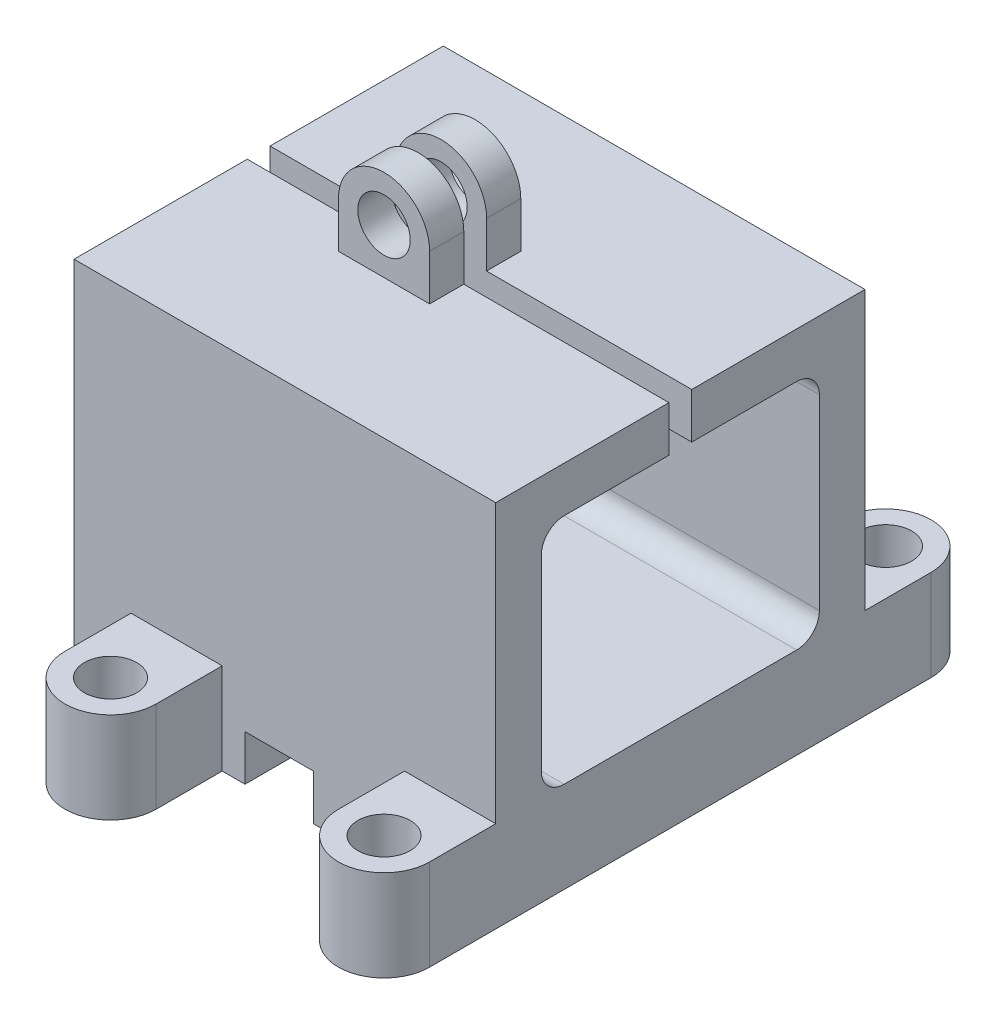
from build123d import *

# Parameters (mm, degrees)
SKETCH_1_W           = 8
SKETCH_1_H           = 5
SKETCH_1_R           = 1.15
EXTRUDE_1_DEPTH      = 4
SKETCH_2_W           = 10.5
SKETCH_2_H           = 8
SKETCH_2_R           = 1.15
EXTRUDE_2_DEPTH      = 7
EXTRUDE_4_DEPTH      = 15
SKETCH_6_R           = 1.15
EXTRUDE_5_DEPTH      = 1.5
EXTRUDE_START        = 2.5
SKETCH_6_2_R         = 1.15
EXTRUDE_6_DEPTH      = 1.5
CUT_EXTRUDE_2_DEPTH  = 3
FILLET_2_R           = 1
SKETCH_9_OUTSIDE_W   = 25.014
SKETCH_9_OUTSIDE_H   = 34.214
SKETCH_9_OUTSIDE_W_2 = 15
SKETCH_9_OUTSIDE_H_2 = 16.2
CUT_EXTRUDE_3_DEPTH  = 36.814522194
SKETCH_12_W          = 16.2
SKETCH_12_H          = 8
CUT_EXTRUDE_5_DEPTH  = 31.608495553
SKETCH_10_W          = 3
SKETCH_10_H          = 2
CUT_EXTRUDE_4_DEPTH  = 31.608495553
SKETCH_11_R          = 1.15
EXTRUDE_7_DEPTH      = 4
EXTRUDE_15_DEPTH     = 3.5


with BuildPart() as part:
    # 草图1 → 凸台-拉伸1 (new body)
    with BuildSketch(Plane(origin=(0, 0, 0), x_dir=(0, 0, -1), z_dir=(1, 0, 0))):
        with Locations((4, 2.5)):
            Rectangle(SKETCH_1_W, SKETCH_1_H)
        with Locations((2, 2.5)):
            Circle(SKETCH_1_R, mode=Mode.SUBTRACT)
        with Locations((6, 2.5)):
            Circle(SKETCH_1_R, mode=Mode.SUBTRACT)
    extrude(amount=EXTRUDE_1_DEPTH)

    # 草图2 → 凸台-拉伸2 (add)
    with BuildSketch(Plane.XZ):
        with Locations((5.25, -4)):
            Rectangle(SKETCH_2_W, SKETCH_2_H)
        with Locations(Location((8, -6, 0), (0, 0, 270))):
            Circle(SKETCH_2_R, mode=Mode.SUBTRACT)
        with Locations(Location((8, -2, 0), (0, 0, 270))):
            Circle(SKETCH_2_R, mode=Mode.SUBTRACT)
    extrude(amount=EXTRUDE_2_DEPTH)

    # 草图5 → 凸台-拉伸4 (add)
    with BuildSketch(Plane.ZY):
        Polygon((14.2, 5), (2, 5), (2, 15.2), (7.6, 15.2), (7.6, 17.2), (0, 17.2), (0, -7), (16.2, -7), (16.2, 17.2), (8.6, 17.2), (8.6, 15.2), (14.2, 15.2), align=None)
    extrude(amount=-EXTRUDE_4_DEPTH)

    # 草图6 → 凸台-拉伸5 (add)
    with BuildSketch(Plane.XY.offset(7.6)):
        with BuildLine():
            Line((2, 19.2), (2, 17.2))
            Line((2, 17.2), (6, 17.2))
            Line((6, 17.2), (6, 19.2))
            ThreePointArc((6, 19.2), (4, 21.2), (2, 19.2))
        make_face()
        with Locations((4, 19.2)):
            Circle(SKETCH_6_R, mode=Mode.SUBTRACT)
    extrude(amount=-EXTRUDE_5_DEPTH)

    # 草图6<2> → 凸台-拉伸6 (add)
    with BuildSketch(Plane.XY.offset(7.6).offset(EXTRUDE_START)):
        with BuildLine():
            Line((2, 19.2), (2, 17.2))
            Line((2, 17.2), (6, 17.2))
            Line((6, 17.2), (6, 19.2))
            ThreePointArc((6, 19.2), (4, 21.2), (2, 19.2))
        make_face()
        with Locations((4, 19.2)):
            Circle(SKETCH_6_2_R, mode=Mode.SUBTRACT)
    extrude(amount=-EXTRUDE_6_DEPTH)

    # 草图8 → 切除-拉伸2 (cut)
    with BuildSketch(Plane(origin=(0, 0, -8), x_dir=(-1, 0, 0), z_dir=(0, 0, -1))):
        Polygon((0, -3), (0, -7), (-4, -7), align=None)
    extrude(amount=-CUT_EXTRUDE_2_DEPTH, mode=Mode.SUBTRACT)

    # 圆角2
    fillet_2_edges = [part.edges().sort_by_distance(p)[0] for p in [
        (7.5, 15.2, 2),
        (7.5, 5, 2),
        (7.5, 5, 14.2),
        (7.5, 15.2, 14.2),
    ]]
    fillet(fillet_2_edges, radius=FILLET_2_R)

    # 草图9 outside → 切除-拉伸3 (cut, through all)
    with BuildSketch(Plane.XZ.offset(7)):
        with Locations((7.5, 4.1)):
            Rectangle(SKETCH_9_OUTSIDE_W, SKETCH_9_OUTSIDE_H)
        with Locations((7.5, 8.1)):
            Rectangle(SKETCH_9_OUTSIDE_W_2, SKETCH_9_OUTSIDE_H_2, mode=Mode.SUBTRACT)
    extrude(amount=-CUT_EXTRUDE_3_DEPTH, mode=Mode.SUBTRACT)

    # 草图12 → 切除-拉伸5 (cut, through all)
    with BuildSketch(Plane(origin=(15, 0, 0), x_dir=(0, 0, -1), z_dir=(1, 0, 0))):
        with Locations((-8.1, -3)):
            Rectangle(SKETCH_12_W, SKETCH_12_H)
    extrude(amount=-CUT_EXTRUDE_5_DEPTH, mode=Mode.SUBTRACT)

    # 草图10 → 切除-拉伸4 (cut, through all)
    with BuildSketch(Plane(origin=(0, 0, 0), x_dir=(-1, 0, 0), z_dir=(0, 0, -1))):
        with Locations((-5.5, 2)):
            Rectangle(SKETCH_10_W, SKETCH_10_H)
    extrude(amount=-CUT_EXTRUDE_4_DEPTH, mode=Mode.SUBTRACT)

    # 草图11 → 凸台-拉伸7 (add)
    # profile 1 of 3: a face of its own
    with BuildSketch(Plane.XZ.offset(-1)):
        with BuildLine():
            Line((0, 16.2), (3, 16.2))
            Line((3, 16.2), (3, 19.1))
            ThreePointArc((3, 19.1), (1, 21.1), (-1, 19.1))
            Line((-1, 19.1), (-1, -2.9))
            ThreePointArc((-1, -2.9), (1, -4.9), (3, -2.9))
            Line((3, -2.9), (3, 0))
            Line((3, 0), (0, 0))
            Line((0, 0), (0, 16.2))
        make_face()
        with Locations(Location((1, 19.1, 0), (0, 0, 270))):
            Circle(SKETCH_11_R, mode=Mode.SUBTRACT)
        with Locations(Location((1, -2.9, 0), (0, 0, 90))):
            Circle(SKETCH_11_R, mode=Mode.SUBTRACT)
    # profile 2 of 3: a face of its own
    with BuildSketch(Plane.XZ.offset(-1)):
        with BuildLine():
            Line((11, 19.1), (11, 16.2))
            Line((11, 16.2), (15, 16.2))
            Line((15, 16.2), (15, 19.1))
            ThreePointArc((15, 19.1), (13, 21.1), (11, 19.1))
        make_face()
        with Locations(Location((13, 19.1, 0), (0, 0, 270))):
            Circle(SKETCH_11_R, mode=Mode.SUBTRACT)
    # profile 3 of 3: a face of its own
    with BuildSketch(Plane.XZ.offset(-1)):
        with BuildLine():
            Line((11, -2.9), (11, 0))
            Line((11, 0), (15, 0))
            Line((15, 0), (15, -2.9))
            ThreePointArc((15, -2.9), (13, -4.9), (11, -2.9))
        make_face()
        with Locations(Location((13, -2.9, 0), (0, 0, 270))):
            Circle(SKETCH_11_R, mode=Mode.SUBTRACT)
    extrude(amount=-EXTRUDE_7_DEPTH)

    # 草图22 → 凸台-拉伸15 (add)
    with BuildSketch(Plane.ZY):
        with BuildLine():
            Line((16.2, 5), (16.2, 17.2))
            Line((16.2, 17.2), (8.6, 17.2))
            Line((8.6, 17.2), (8.6, 15.2))
            Line((8.6, 15.2), (13.2, 15.2))
            ThreePointArc((13.2, 15.2), (13.907106781, 14.907106781), (14.2, 14.2))
            Line((14.2, 14.2), (14.2, 6))
            ThreePointArc((14.2, 6), (13.907106781, 5.292893219), (13.2, 5))
            Line((13.2, 5), (3, 5))
            ThreePointArc((3, 5), (2.292893219, 5.292893219), (2, 6))
            Line((2, 6), (2, 14.2))
            ThreePointArc((2, 14.2), (2.292893219, 14.907106781), (3, 15.2))
            Line((3, 15.2), (7.6, 15.2))
            Line((7.6, 15.2), (7.6, 17.2))
            Line((7.6, 17.2), (0, 17.2))
            Line((0, 17.2), (0, 5))
            Line((0, 5), (0, 1))
            Line((0, 1), (16.2, 1))
            Line((16.2, 1), (16.2, 5))
        make_face()
    extrude(amount=EXTRUDE_15_DEPTH)


solid = part.part
